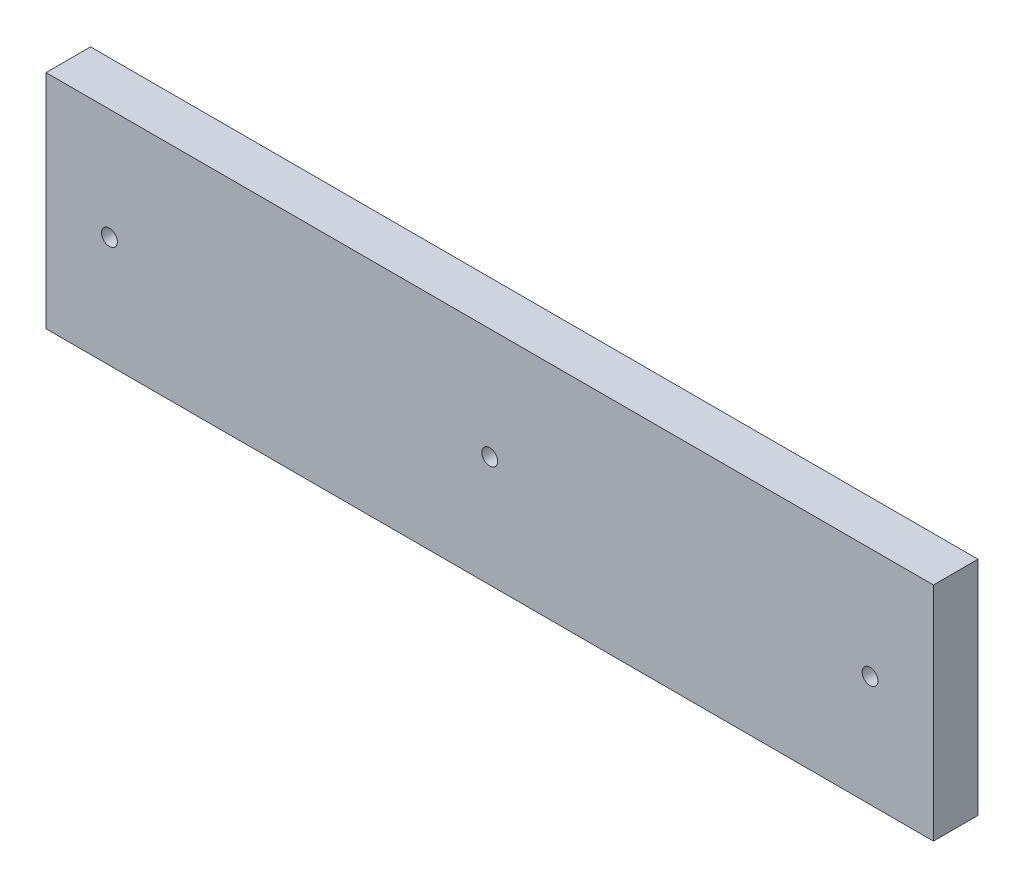
from build123d import *

# Parameters (mm, degrees)
SKETCH2_W           = 355.6
SKETCH2_H           = 88.9
SKETCH2_R           = 3.175
BOSS_EXTRUDE2_DEPTH = 17.8562


with BuildPart() as part:
    # Sketch2 → Boss-Extrude2 (new body)
    with BuildSketch(Plane.XY):
        Rectangle(SKETCH2_W, SKETCH2_H)
        with Locations((-152.4, 0)):
            Circle(SKETCH2_R, mode=Mode.SUBTRACT)
        Circle(SKETCH2_R, mode=Mode.SUBTRACT)
        with Locations((152.4, 0)):
            Circle(SKETCH2_R, mode=Mode.SUBTRACT)
    extrude(amount=BOSS_EXTRUDE2_DEPTH)


solid = part.part
